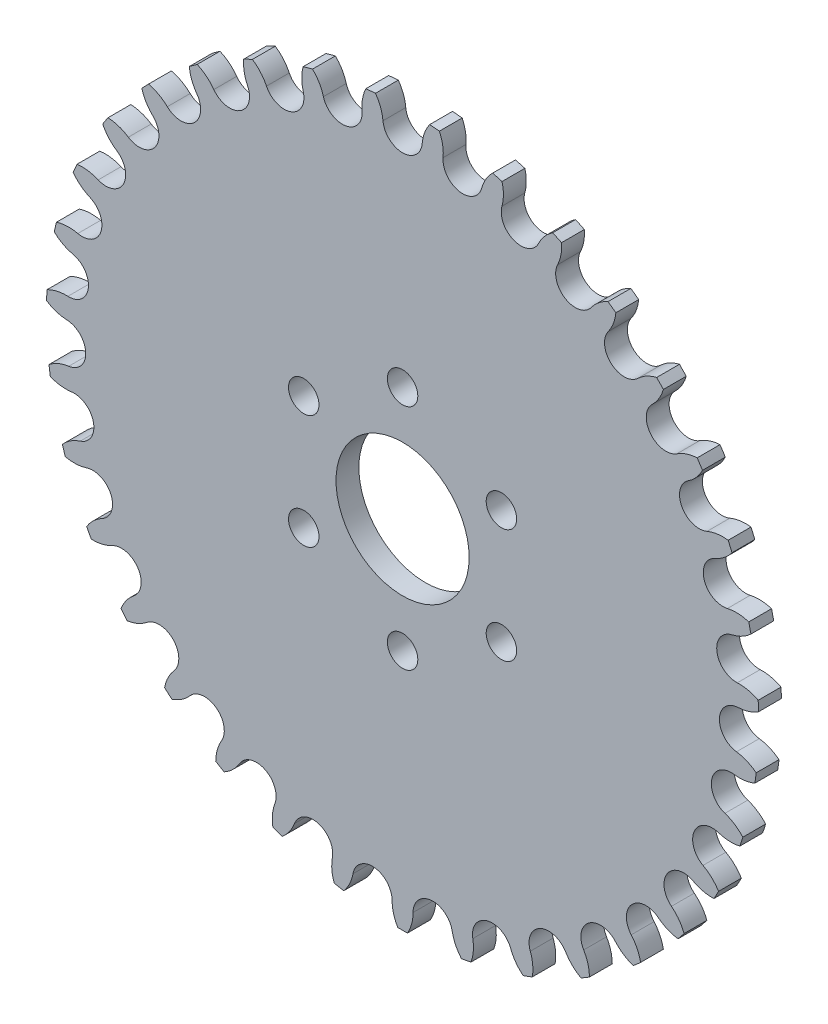
from build123d import *

# Parameters (mm, degrees)
EXTRUDE_1_DEPTH          = 6
PATTERN_CIRCULAR_1_COUNT = 35
SKETCH_3_R               = 17.5
SKETCH_3_R_2             = 4
CUT_EXTRUDE_1_DEPTH      = 133.515476965


with BuildPart() as part:
    # Эскиз2 → Бобышка-Вытянуть1 (new body)
    with BuildSketch(Plane.XY):
        with BuildLine():
            Line((0, 0), (0, 83.369321688))
            ThreePointArc((0, 83.369321688), (3.494793428, 84.725865281), (5.159146843, 88.084990068))
            ThreePointArc((5.159146843, 88.084990068), (5.786321636, 90.852824972), (7.119388663, 93.358257186))
            ThreePointArc((7.119388663, 93.358257186), (8.392867689, 93.252397566), (9.664783349, 93.129167518))
            ThreePointArc((9.664783349, 93.129167518), (10.529065244, 90.425970322), (10.651945074, 87.59062928))
            ThreePointArc((10.651945074, 87.59062928), (11.689756754, 83.988305232), (14.886167202, 82.02954239))
            Line((14.886167202, 82.02954239), (0, 0))
        make_face()
    extrude_1 = extrude(amount=EXTRUDE_1_DEPTH)

    # Круговой массив1: Бобышка-Вытянуть1 ×35 about axis
    pattern_circular_1_axis = Axis((0, 0, 0), (0, 0, 1))
    for i in range(1, PATTERN_CIRCULAR_1_COUNT):
        add(extrude_1.rotate(pattern_circular_1_axis, i * 360 / PATTERN_CIRCULAR_1_COUNT))

    # Эскиз3 → Вырез-Вытянуть1 (cut, through all)
    with BuildSketch(Plane.XY.offset(6)):
        Circle(SKETCH_3_R)
        with Locations((0, 30)):
            Circle(SKETCH_3_R_2)
        with Locations((25.980762114, 15)):
            Circle(SKETCH_3_R_2)
        with Locations((25.980762114, -15)):
            Circle(SKETCH_3_R_2)
        with Locations((0, -30)):
            Circle(SKETCH_3_R_2)
        with Locations((-25.980762114, -15)):
            Circle(SKETCH_3_R_2)
        with Locations((-25.980762114, 15)):
            Circle(SKETCH_3_R_2)
    extrude(amount=-CUT_EXTRUDE_1_DEPTH, mode=Mode.SUBTRACT)


solid = part.part
